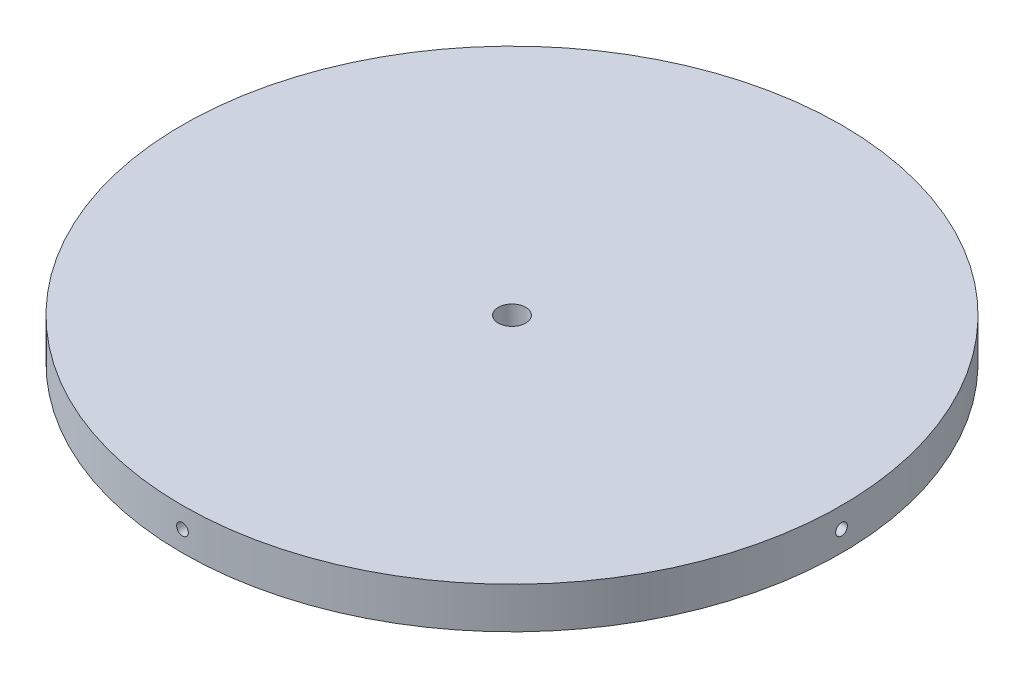
from build123d import *

# Parameters (mm, degrees)
SKETCH1_R           = 76.1746
SKETCH1_R_2         = 3.175
BOSS_EXTRUDE1_DEPTH = 9.525
CIRPATTERN1_COUNT   = 4


with BuildPart() as part:
    # Sketch1 → Boss-Extrude1 (new body)
    with BuildSketch(Plane(origin=(0, 0, 0), x_dir=(1, 0, 0), z_dir=(0, 1, 0))):
        with Locations(Location((0, 0, 0), (0, 0, 90))):
            Circle(SKETCH1_R)
        with Locations(Location((0, 0, 0), (0, 0, 90))):
            Circle(SKETCH1_R_2, mode=Mode.SUBTRACT)
    extrude(amount=BOSS_EXTRUDE1_DEPTH)

    # Sketch3 → Tap Drill for #6-32 Tap1 (revolve, cut)
    with BuildSketch(Plane(origin=(0, 4.7625, -76.1746), x_dir=(0, 1, 0), z_dir=(1, 0, 0))):
        Polygon((0, 0), (0, 10.46469403), (1.35255, 9.652), (1.35255, 0), align=None)
    tap_drill_for_6_32_tap1 = revolve(axis=Axis((0, 4.7625, -82.5246), (0, 0, 1)), mode=Mode.SUBTRACT)

    # CirPattern1: Tap Drill for #6-32 Tap1 ×4 about axis
    cirpattern1_axis = Axis((0, 9.525, 0), (0, 1, 0))
    for i in range(1, CIRPATTERN1_COUNT):
        add(tap_drill_for_6_32_tap1.rotate(cirpattern1_axis, i * 360 / CIRPATTERN1_COUNT), mode=Mode.SUBTRACT)


solid = part.part
